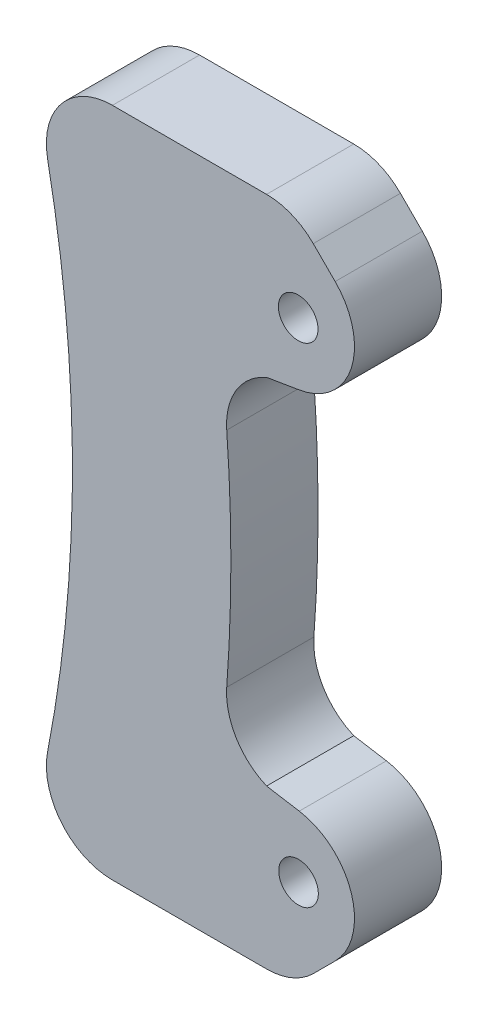
from build123d import *

# Parameters (mm, degrees)
MODEL_R             = 1.5
BOSS_EXTRUDE1_DEPTH = 6.6


with BuildPart() as part:
    # Model → Boss-Extrude1 (new body)
    with BuildSketch(Plane.XY):
        with BuildLine():
            Line((0.403470192, -13.809994881), (-2.071067812, -13.4))
            ThreePointArc((-2.071067812, -13.4), (-4.374720312, -11.399768226), (-5.087238474, -8.433278742))
            ThreePointArc((-5.087238474, -8.433278742), (-4.773776994, 0), (-5.087238474, 8.433278742))
            ThreePointArc((-5.087238474, 8.433278742), (-4.374720312, 11.399768226), (-2.071067812, 13.4))
            Line((-2.071067812, 13.4), (0.403470192, 13.809994881))
            ThreePointArc((0.403470192, 13.809994881), (4.346933521, 17.214586867), (3.121718942, 22.278281058))
            Line((3.121718942, 22.278281058), (1.464466094, 23.935533906))
            ThreePointArc((1.464466094, 23.935533906), (-0.15765065, 25.019397663), (-2.071067812, 25.4))
            Line((-2.071067812, 25.4), (-13.74395333, 25.4))
            ThreePointArc((-13.74395333, 25.4), (-17.602984306, 23.579289217), (-18.651543558, 19.44315197))
            ThreePointArc((-18.651543558, 19.44315197), (-16.773776994, 0), (-18.651543558, -19.44315197))
            ThreePointArc((-18.651543558, -19.44315197), (-17.602984306, -23.579289217), (-13.74395333, -25.4))
            Line((-13.74395333, -25.4), (-2.071067812, -25.4))
            ThreePointArc((-2.071067812, -25.4), (-0.15765065, -25.019397663), (1.464466094, -23.935533906))
            Line((1.464466094, -23.935533906), (3.121718942, -22.278281058))
            ThreePointArc((3.121718942, -22.278281058), (4.346933521, -17.214586867), (0.403470192, -13.809994881))
        make_face()
        with Locations((0.325033172, 18.5)):
            Circle(MODEL_R, mode=Mode.SUBTRACT)
        with Locations((0.348456442, -18.5)):
            Circle(MODEL_R, mode=Mode.SUBTRACT)
    extrude(amount=BOSS_EXTRUDE1_DEPTH)


solid = part.part
